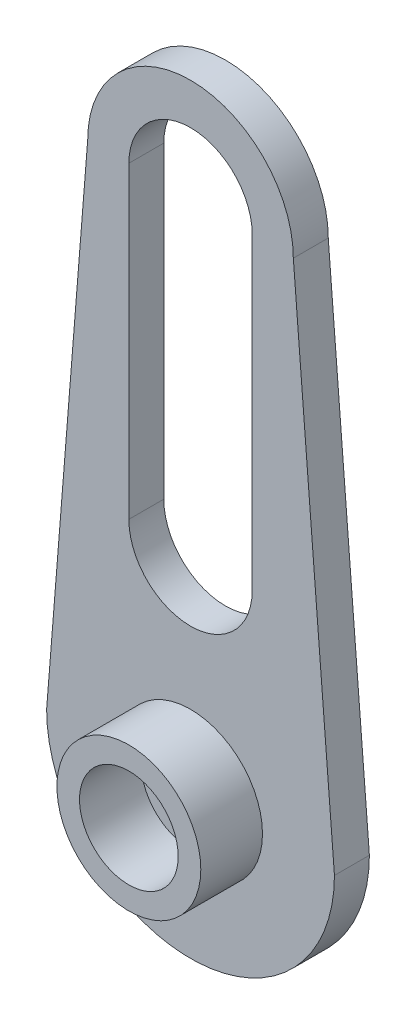
from build123d import *

# Parameters (mm, degrees)
CROQUIS1_R              = 1.1
SALIENTE_EXTRUIR1_DEPTH = 1.7
CROQUIS2_R              = 3.5
CROQUIS2_R_2            = 2.4
SALIENTE_EXTRUIR2_DEPTH = 3
CROQUIS3_R              = 2.25
CORTAR_EXTRUIR1_DEPTH   = 1


with BuildPart() as part:
    # Croquis1 → Saliente-Extruir1 (new body)
    with BuildSketch(Plane.XY):
        with BuildLine():
            ThreePointArc((5, 25), (0, 30), (-5, 25))
            Line((-5, 25), (-6.910969793, 1.112877583))
            Line((-6.910969793, 1.112877583), (-7, 0))
            ThreePointArc((-7, 0), (0, -7), (7, 0))
            Line((7, 0), (6.910969793, 1.112877583))
            Line((6.910969793, 1.112877583), (5, 25))
        make_face()
        Circle(CROQUIS1_R, mode=Mode.SUBTRACT)
        with BuildLine():
            ThreePointArc((-3, 25), (0, 28), (3, 25))
            Line((3, 25), (3, 10))
            ThreePointArc((3, 10), (0, 7), (-3, 10))
            Line((-3, 10), (-3, 25))
        make_face(mode=Mode.SUBTRACT)
    extrude(amount=SALIENTE_EXTRUIR1_DEPTH)

    # Croquis2 → Saliente-Extruir2 (add)
    with BuildSketch(Plane.XY.offset(1.7)):
        Circle(CROQUIS2_R)
        Circle(CROQUIS2_R_2, mode=Mode.SUBTRACT)
    extrude(amount=SALIENTE_EXTRUIR2_DEPTH)

    # Croquis3 → Cortar-Extruir1 (cut)
    with BuildSketch(Plane(origin=(0, 0, 0), x_dir=(-1, 0, 0), z_dir=(0, 0, -1))):
        Circle(CROQUIS3_R)
    extrude(amount=-CORTAR_EXTRUIR1_DEPTH, mode=Mode.SUBTRACT)


solid = part.part
